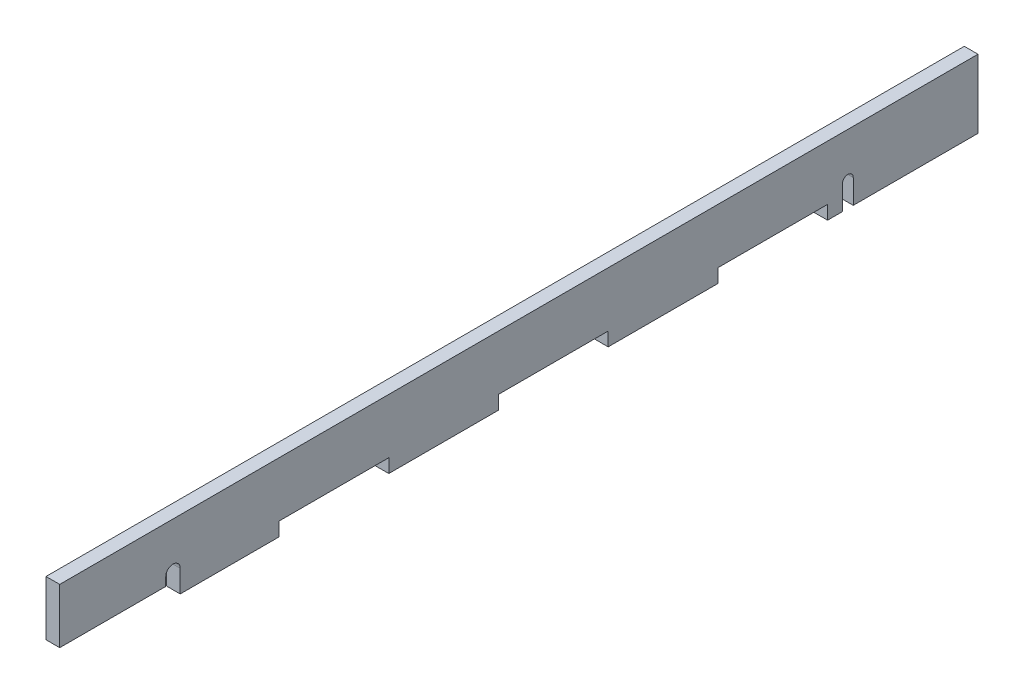
from build123d import *

# Parameters (mm, degrees)
BOSS_EXTRUDE1_DEPTH = 6.35
CUT_EXTRUDE1_REACH  = 426.028
CUT_EXTRUDE2_DEPTH  = 425.027574582


with BuildPart() as part:
    # Sketch2 → Boss-Extrude1 (new body)
    with BuildSketch(Plane(origin=(0, 0, 0), x_dir=(0, 0, -1), z_dir=(1, 0, 0))):
        Polygon((48.319405744, 0), (99.119405744, 0), (99.119405744, 6.35), (149.919405744, 6.35), (149.919405744, 0), (200.719405744, 0), (200.719405744, 6.35), (251.519405744, 6.35), (251.519405744, 0), (302.319405744, 0), (302.319405744, 6.35), (353.119405744, 6.35), (353.119405744, 0), (422.789544579, 0), (422.789544579, 31.75), (-2.480594256, 31.75), (-2.480594256, 6.35), (48.319405744, 6.35), align=None)
    extrude(amount=BOSS_EXTRUDE1_DEPTH)

    # Sketch3 → Cut-Extrude1 (cut, up to next)
    with BuildSketch(Plane(origin=(6.35, 0, 0), x_dir=(0, 0, -1), z_dir=(1, 0, 0)), mode=Mode.PRIVATE) as cut_extrude1_sk1:
        with BuildLine():
            Line((365.019405744, 11.16), (365.019405744, -0.034586793))
            Line((365.019405744, -0.034586793), (360.019405744, -0.034586793))
            Line((360.019405744, -0.034586793), (360.019405744, 11.16))
            ThreePointArc((360.019405744, 11.16), (362.519405744, 13.66), (365.019405744, 11.16))
        make_face()
    cut_extrude1_tool1 = extrude(cut_extrude1_sk1.sketch, amount=-CUT_EXTRUDE1_REACH, mode=Mode.PRIVATE) & part.part
    add(cut_extrude1_tool1.solids().sort_by_distance((6.35, 6.556286, -362.519406))[0], mode=Mode.SUBTRACT)

    # Sketch4 → Cut-Extrude2 (cut, through all)
    with BuildSketch(Plane(origin=(6.35, 0, 0), x_dir=(0, 0, -1), z_dir=(1, 0, 0))):
        with BuildLine():
            Line((53.319405744, 10.31), (53.319405744, 0))
            Line((53.319405744, 0), (48.319405744, 0))
            Line((48.319405744, 0), (48.319405744, 6.35))
            Line((48.319405744, 6.35), (46.619405744, 6.35))
            Line((46.619405744, 6.35), (46.619405744, 10.31))
            ThreePointArc((46.619405744, 10.31), (49.969405744, 13.66), (53.319405744, 10.31))
        make_face()
    extrude(amount=-CUT_EXTRUDE2_DEPTH, mode=Mode.SUBTRACT)


solid = part.part
